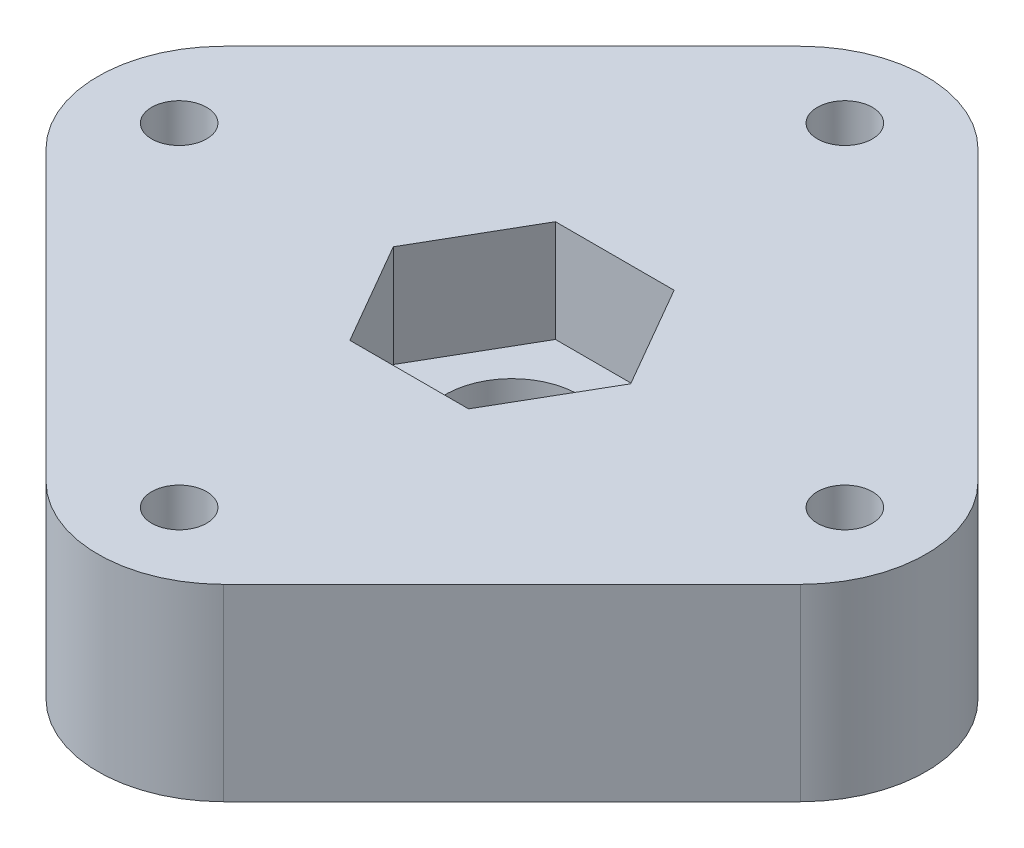
from build123d import *

# Parameters (mm, degrees)
SKETCH_1_R          = 1.75
SKETCH_1_R_2        = 4.25
EXTRUDE_1_DEPTH     = 12
CUT_EXTRUDE_1_DEPTH = 6.5
CUT_EXTRUDE_2_DEPTH = 2.5


with BuildPart() as part:
    # Эскиз1 → Бобышка-Вытянуть1 (new body)
    with BuildSketch(Plane(origin=(0, 0, 0), x_dir=(1, 0, 0), z_dir=(0, 1, 0))):
        with BuildLine():
            Line((5.656854249, -24.04163056), (24.04163056, -5.656854249))
            ThreePointArc((24.04163056, -5.656854249), (26.384776311, 0), (24.04163056, 5.656854249))
            Line((24.04163056, 5.656854249), (5.656854249, 24.04163056))
            ThreePointArc((5.656854249, 24.04163056), (0, 26.384776311), (-5.656854249, 24.04163056))
            Line((-5.656854249, 24.04163056), (-24.04163056, 5.656854249))
            ThreePointArc((-24.04163056, 5.656854249), (-26.384776311, 0), (-24.04163056, -5.656854249))
            Line((-24.04163056, -5.656854249), (-5.656854249, -24.04163056))
            ThreePointArc((-5.656854249, -24.04163056), (0, -26.384776311), (5.656854249, -24.04163056))
        make_face()
        with Locations(Location((21.213203436, 0, 0), (0, 0, 270))):
            Circle(SKETCH_1_R, mode=Mode.SUBTRACT)
        with Locations(Location((0, -21.213203436, 0), (0, 0, 270))):
            Circle(SKETCH_1_R, mode=Mode.SUBTRACT)
        with Locations(Location((-21.213203436, 0, 0), (0, 0, 270))):
            Circle(SKETCH_1_R, mode=Mode.SUBTRACT)
        with Locations(Location((0, 21.213203436, 0), (0, 0, 270))):
            Circle(SKETCH_1_R, mode=Mode.SUBTRACT)
        with Locations(Location((0, 0, 0), (0, 0, 270))):
            Circle(SKETCH_1_R_2, mode=Mode.SUBTRACT)
    extrude(amount=EXTRUDE_1_DEPTH)

    # Эскиз2 → Вырез-Вытянуть1 (cut)
    with BuildSketch(Plane(origin=(0, 12, 0), x_dir=(1, 0, 0), z_dir=(0, 1, 0))):
        Polygon((3.781644263, -6.55), (7.563288526, 0), (3.781644263, 6.55), (-3.781644263, 6.55), (-7.563288526, 0), (-3.781644263, -6.55), align=None)
    extrude(amount=-CUT_EXTRUDE_1_DEPTH, mode=Mode.SUBTRACT)

    # Эскиз4 → Вырез-Вытянуть2 (cut)
    with BuildSketch(Plane.XZ):
        Polygon((24.063203436, -1.645448267), (24.063203436, 1.645448267), (21.213203436, 3.290896534), (18.363203436, 1.645448267), (18.363203436, -1.645448267), (21.213203436, -3.290896534), align=None)
        Polygon((-1.645448267, 18.363203436), (1.645448267, 18.363203436), (3.290896534, 21.213203436), (1.645448267, 24.063203436), (-1.645448267, 24.063203436), (-3.290896534, 21.213203436), align=None)
        Polygon((-1.645448267, -24.063203436), (1.645448267, -24.063203436), (3.290896534, -21.213203436), (1.645448267, -18.363203436), (-1.645448267, -18.363203436), (-3.290896534, -21.213203436), align=None)
        Polygon((-24.063203436, 1.645448267), (-24.063203436, -1.645448267), (-21.213203436, -3.290896534), (-18.363203436, -1.645448267), (-18.363203436, 1.645448267), (-21.213203436, 3.290896534), align=None)
    extrude(amount=-CUT_EXTRUDE_2_DEPTH, mode=Mode.SUBTRACT)


solid = part.part
